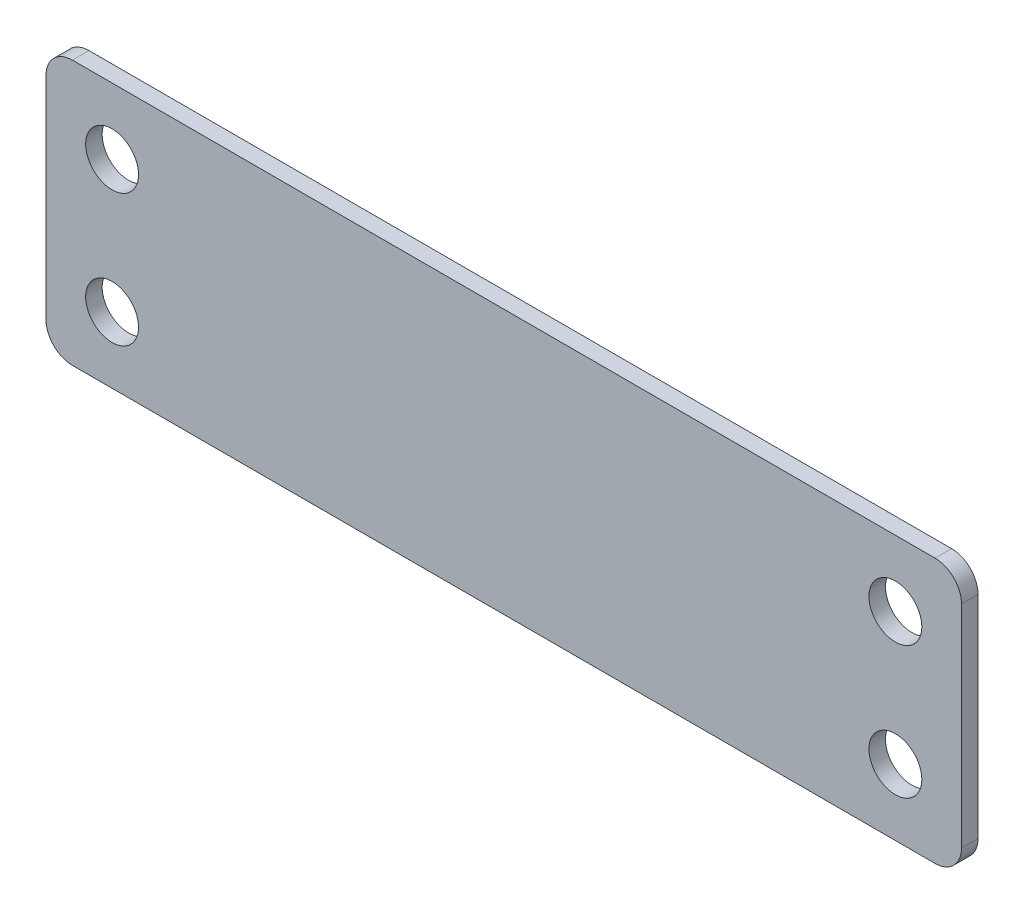
from build123d import *

# Parameters (mm, degrees)
SKETCH1_W           = 87.95004
SKETCH1_H           = 25.4
BOSS_EXTRUDE1_DEPTH = 1.5875
FILLET1_R           = 2.54
SKETCH2_R           = 2.54
CUT_EXTRUDE1_DEPTH  = 2.54


with BuildPart() as part:
    # Sketch1 → Boss-Extrude1 (new body)
    with BuildSketch(Plane.XY):
        with Locations((-43.97502, 12.7)):
            Rectangle(SKETCH1_W, SKETCH1_H)
    extrude(amount=BOSS_EXTRUDE1_DEPTH)

    # Fillet1
    fillet1_edges = [part.edges().sort_by_distance(p)[0] for p in [
        (0, 0, 0.79375),
        (-87.95004, 0, 0.79375),
        (-87.95004, 25.4, 0.79375),
        (0, 25.4, 0.79375),
    ]]
    fillet(fillet1_edges, radius=FILLET1_R)

    # Sketch2 → Cut-Extrude1 (cut)
    with BuildSketch(Plane.XY.offset(1.5875)):
        with Locations((-81.60004, 19.05)):
            Circle(SKETCH2_R)
        with Locations((-81.60004, 6.35)):
            Circle(SKETCH2_R)
        with Locations((-6.35, 19.05)):
            Circle(SKETCH2_R)
        with Locations((-6.35, 6.35)):
            Circle(SKETCH2_R)
    extrude(amount=-CUT_EXTRUDE1_DEPTH, mode=Mode.SUBTRACT)


solid = part.part
